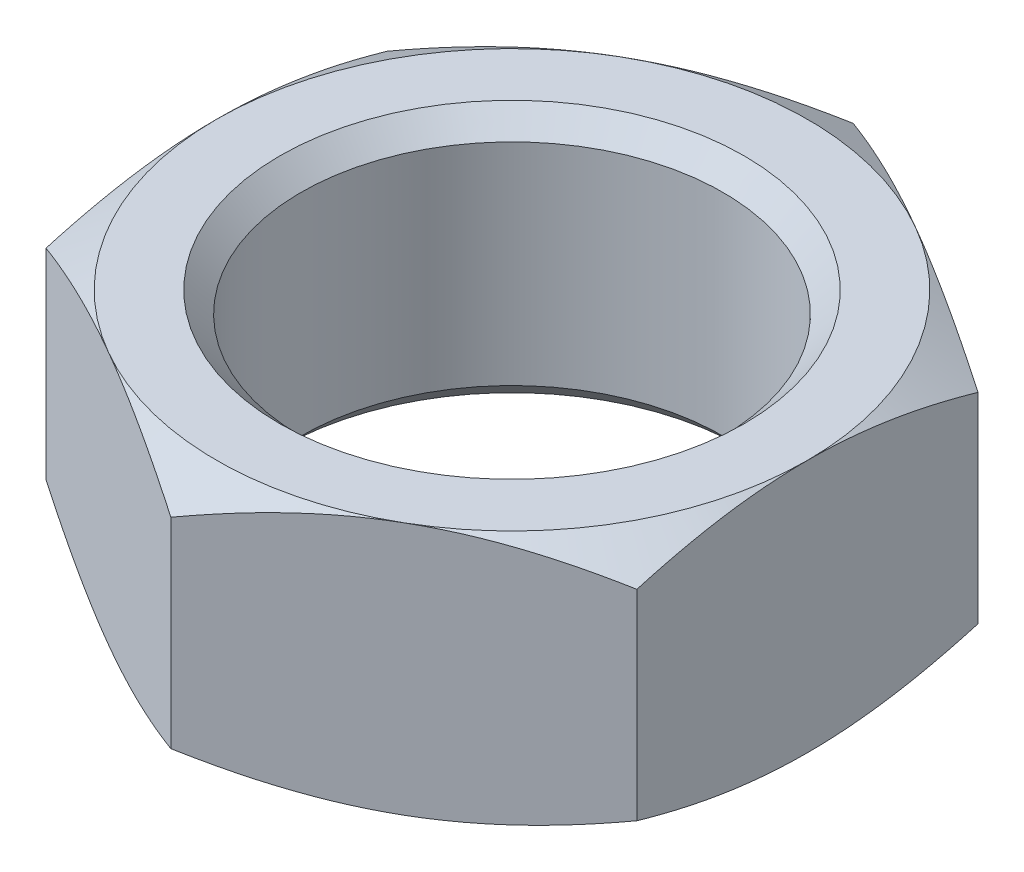
from build123d import *

# Parameters (mm, degrees)
BOSS_EXTRUDE1_DEPTH     = 6
SKETCH2_OUTSIDE_W       = 80.454
SKETCH2_OUTSIDE_H       = 84.786
SKETCH2_OUTSIDE_R       = 14
CUT_EXTRUDE1_DEPTH      = 12
CUT_EXTRUDE1_DRAFT      = -60
MIRROR1_COPY_1_SKETCH_W = 80.454
MIRROR1_COPY_1_SKETCH_H = 84.786
MIRROR1_COPY_1_SKETCH_R = 14
MIRROR1_COPY_1_DEPTH    = 12
MIRROR1_COPY_1_DRAFT    = -60
SKETCH3_R               = 10
CUT_EXTRUDE2_DEPTH      = 25.522098877
CHAMFER1_SIZE           = 1


with BuildPart() as part:
    # Sketch1 → Boss-Extrude1 (new, symmetric)
    with BuildSketch(Plane(origin=(0, 0, 0), x_dir=(1, 0, 0), z_dir=(0, 1, 0))):
        Polygon((0, 16.165807537), (-14, 8.082903769), (-14, -8.082903769), (0, -16.165807537), (14, -8.082903769), (14, 8.082903769), align=None)
    extrude(amount=BOSS_EXTRUDE1_DEPTH, both=True)


with BuildPart() as cut_extrude1_tool:
    # Sketch2 outside → Cut-Extrude1 (with draft: the straight prism first)
    with BuildSketch(Plane(origin=(0, 6, 0), x_dir=(1, 0, 0), z_dir=(0, 1, 0))):
        Rectangle(SKETCH2_OUTSIDE_W, SKETCH2_OUTSIDE_H)
        Circle(SKETCH2_OUTSIDE_R, mode=Mode.SUBTRACT)
    extrude(amount=-CUT_EXTRUDE1_DEPTH)
    # Cut-Extrude1: the draft: its side faces are tilted about the plane it starts from
    cut_extrude1_sides = [cut_extrude1_tool.faces().sort_by_distance(p)[0] for p in [
        (0, 0, 42.393),
        (40.227, 0, 0),
        (0, 0, -42.393),
        (-40.227, 0, 0),
        (-14, 0, 0),
    ]]
    draft(cut_extrude1_sides, Plane(origin=(0, 6, 0), x_dir=(1, 0, 0), z_dir=(0, 1, 0)), CUT_EXTRUDE1_DRAFT)


with BuildPart() as part_1:
    add(part.part)

    # Cut-Extrude1: cut by cut_extrude1_tool
    add(cut_extrude1_tool.part, mode=Mode.SUBTRACT)


with BuildPart() as mirror1_copy_1_tool:
    # Mirror1 copy 1 sketch → Mirror1 copy 1 (with draft: the straight prism first)
    with BuildSketch(Plane.XZ.offset(6)):
        Rectangle(MIRROR1_COPY_1_SKETCH_W, MIRROR1_COPY_1_SKETCH_H)
        Circle(MIRROR1_COPY_1_SKETCH_R, mode=Mode.SUBTRACT)
    extrude(amount=-MIRROR1_COPY_1_DEPTH)
    # Mirror1 copy 1: the draft: its side faces are tilted about the plane it starts from
    mirror1_copy_1_sides = [mirror1_copy_1_tool.faces().sort_by_distance(p)[0] for p in [
        (0, 0, 42.393),
        (40.227, 0, 0),
        (0, 0, -42.393),
        (-40.227, 0, 0),
        (-14, 0, 0),
    ]]
    draft(mirror1_copy_1_sides, Plane.XZ.offset(6), MIRROR1_COPY_1_DRAFT)


with BuildPart() as part_2:
    add(part_1.part)

    # Mirror1 copy 1: cut by mirror1_copy_1_tool
    add(mirror1_copy_1_tool.part, mode=Mode.SUBTRACT)

    # Sketch3 → Cut-Extrude2 (cut, through all)
    with BuildSketch(Plane(origin=(0, 6, 0), x_dir=(1, 0, 0), z_dir=(0, 1, 0))):
        with Locations(Location((0, 0, 0), (0, 0, 270))):
            Circle(SKETCH3_R)
    extrude(amount=-CUT_EXTRUDE2_DEPTH, mode=Mode.SUBTRACT)

    # Chamfer1
    chamfer1_edges = [part_2.edges().sort_by_distance(p)[0] for p in [
        (0, -6, -10),
        (0, 6, -10),
    ]]
    chamfer(chamfer1_edges, length=CHAMFER1_SIZE)


solid = part_2.part
